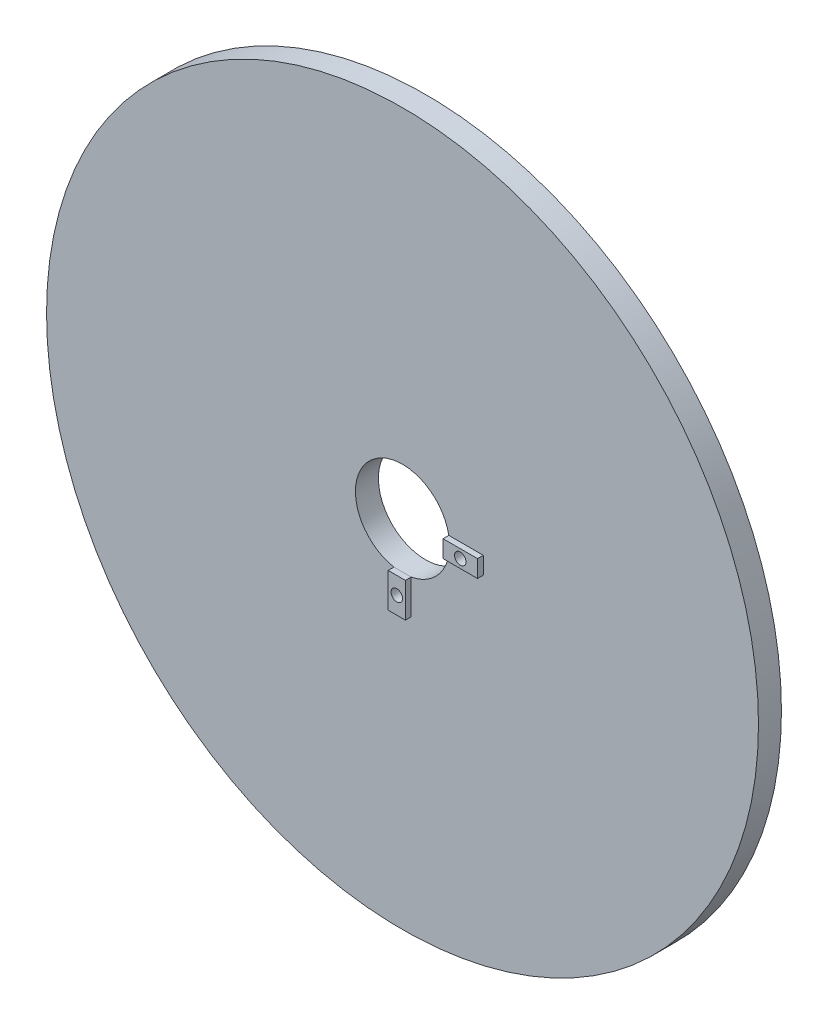
from build123d import *

# Parameters (mm, degrees)
IZIM2_R                     = 15.5
IZIM2_R_2                   = 2.05
Y_KSEKLIK_EKSTR_ZYON1_DEPTH = 1
IZIM3_W                     = 1.5
IZIM3_H                     = 0.75
IZIM3_R                     = 0.25
IZIM3_W_2                   = 0.75
IZIM3_H_2                   = 1.5
Y_KSEKLIK_EKSTR_ZYON2_DEPTH = 0.25
KES_EKSTR_ZYON1_DEPTH       = 22.943108257
KES_EKSTR_ZYON1_DEPTH_BACK  = 22.943108257
IZIM3_3_R                   = 0.25


with BuildPart() as part:
    # Çizim2 → Yükseklik-Ekstrüzyon1 (new body)
    with BuildSketch(Plane.XY.offset(2)):
        Circle(IZIM2_R)
        Circle(IZIM2_R_2, mode=Mode.SUBTRACT)
    extrude(amount=Y_KSEKLIK_EKSTR_ZYON1_DEPTH)

    # Çizim3 → Yükseklik-Ekstrüzyon2 (add)
    # profile 1 of 2: a face of its own
    with BuildSketch(Plane.XY.offset(3)):
        with Locations((2.765409388, 0)):
            Rectangle(IZIM3_W, IZIM3_H)
        with Locations((2.765409388, 0)):
            Circle(IZIM3_R, mode=Mode.SUBTRACT)
    # profile 2 of 2: a face of its own
    with BuildSketch(Plane.XY.offset(3)):
        with Locations((0, -2.765409388)):
            Rectangle(IZIM3_W_2, IZIM3_H_2)
        with Locations((0, -2.765409388)):
            Circle(IZIM3_R, mode=Mode.SUBTRACT)
    extrude(amount=Y_KSEKLIK_EKSTR_ZYON2_DEPTH)

    # Çizim3<3> → Kes-Ekstrüzyon1 (cut, two sides: drawn at the far end of the back side and taken through both)
    with BuildSketch(Plane.XY.offset(3).offset(-KES_EKSTR_ZYON1_DEPTH_BACK)):
        with Locations((2.765409388, 0)):
            Circle(IZIM3_3_R)
        with Locations((0, -2.765409388)):
            Circle(IZIM3_3_R)
    extrude(amount=KES_EKSTR_ZYON1_DEPTH + KES_EKSTR_ZYON1_DEPTH_BACK, mode=Mode.SUBTRACT)


solid = part.part
